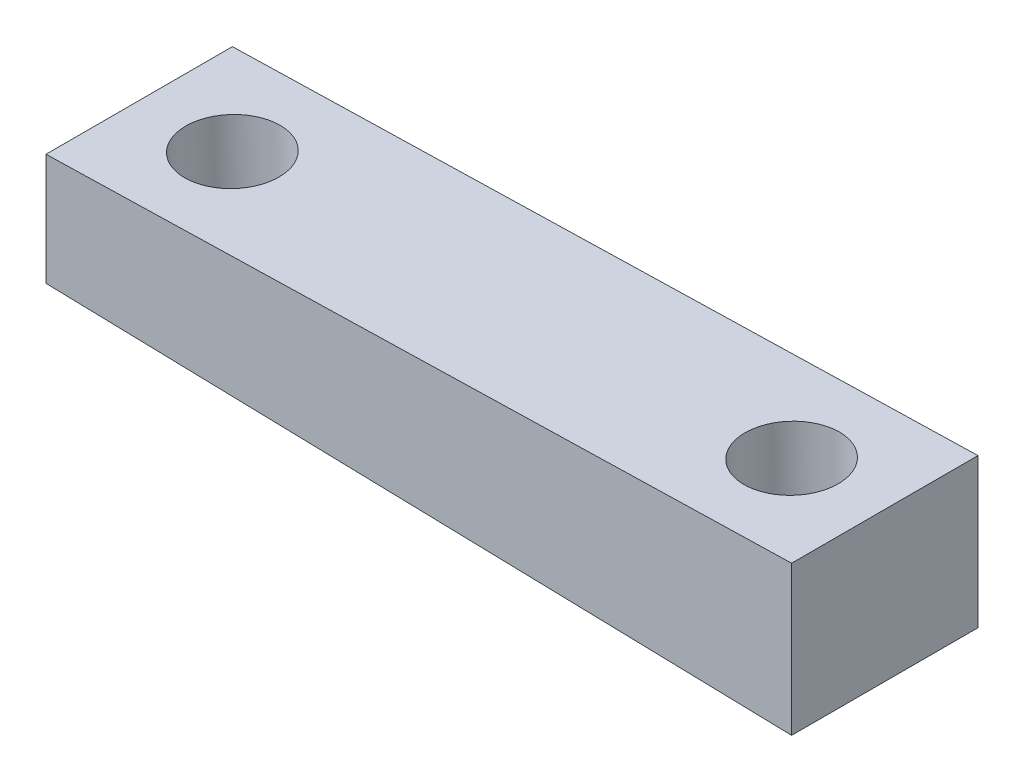
from build123d import *

# Parameters (mm, degrees)
BOSS_EXTRU_1_DEPTH      = 10
ESQUISSE2_R             = 2.5
ENL_V_MAT_EXTRU_1_DEPTH = 42.821047333


with BuildPart() as part:
    # Esquisse1 → Boss.-Extru.1 (new body)
    with BuildSketch(Plane.XY):
        Polygon((0, 0), (40, 1), (40, -7), (0, -6), align=None)
    extrude(amount=BOSS_EXTRU_1_DEPTH)

    # Esquisse2 → Enlèv. mat.-Extru.1 (cut, through all)
    with BuildSketch(Plane(origin=(0, 0, 0), x_dir=(0.9996876464081228, 0.024992191160203233, 0), z_dir=(-0.02499219116020323, 0.9996876464081227, 0))):
        with Locations(Location((5, -5, 0), (0, 0, 180))):
            Circle(ESQUISSE2_R)
        with Locations(Location((35.012498047, -5, 0), (0, 0, 180))):
            Circle(ESQUISSE2_R)
    extrude(amount=-ENL_V_MAT_EXTRU_1_DEPTH, mode=Mode.SUBTRACT)


solid = part.part
